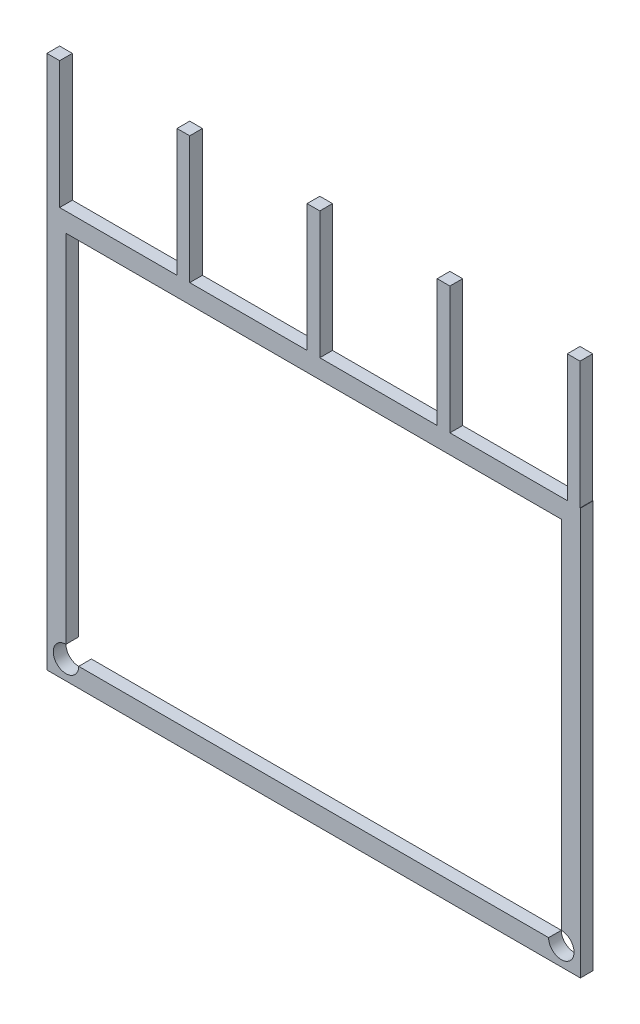
from build123d import *

# Parameters (mm, degrees)
SKETCH1_W           = 41.95
SKETCH1_H           = 31.993
BOSS_EXTRUDE1_DEPTH = 0.5
SKETCH2_W           = 1
SKETCH2_H           = 1
BOSS_EXTRUDE2_DEPTH = 10
LPATTERN1_COUNT     = 5
LPATTERN1_PITCH     = 10.23


with BuildPart() as part:
    # Sketch1 → Boss-Extrude1 (new, symmetric)
    with BuildSketch(Plane.XY):
        Rectangle(SKETCH1_W, SKETCH1_H)
        with BuildLine():
            Line((18.475, -14.4965), (-18.475, -14.4965))
            ThreePointArc((-18.475, -14.4965), (-20.182106781, -15.203606781), (-19.475, -13.4965))
            Line((-19.475, -13.4965), (-19.475, 14.4965))
            Line((-19.475, 14.4965), (19.475, 14.4965))
            Line((19.475, 14.4965), (19.475, -13.4965))
            ThreePointArc((19.475, -13.4965), (20.182106781, -13.789393219), (20.475, -14.4965))
            ThreePointArc((20.475, -14.4965), (19.475, -15.4965), (18.475, -14.4965))
        make_face(mode=Mode.SUBTRACT)
    extrude(amount=BOSS_EXTRUDE1_DEPTH, both=True)

    # Sketch2 → Boss-Extrude2 (add)
    with BuildSketch(Plane(origin=(0, 15.9965, 0), x_dir=(1, 0, 0), z_dir=(0, 1, 0))):
        with Locations((-20.475, 0)):
            Rectangle(SKETCH2_W, SKETCH2_H)
    boss_extrude2 = extrude(amount=BOSS_EXTRUDE2_DEPTH)

    # LPattern1: Boss-Extrude2 ×5
    with Locations(*[(i * LPATTERN1_PITCH, 0, 0) for i in range(1, LPATTERN1_COUNT)]):
        add(boss_extrude2)


solid = part.part
